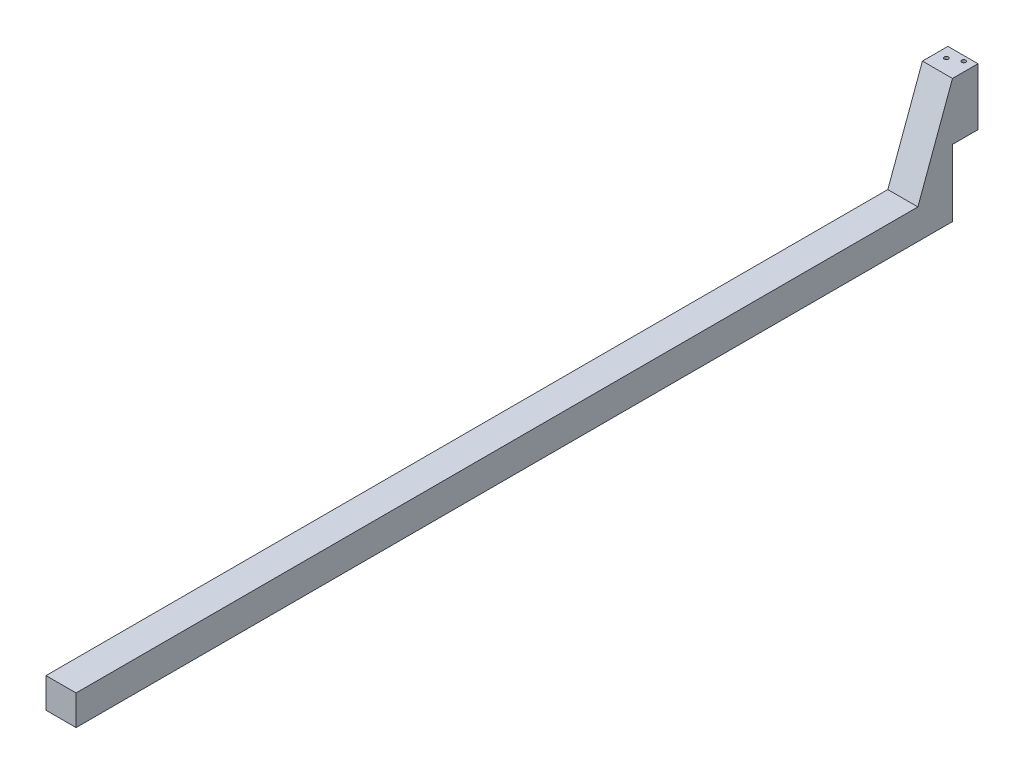
from build123d import *

# Parameters (mm, degrees)
SKETCH1_W                 = 20
SKETCH1_H                 = 82.5
BOSS_EXTRUDE1_DEPTH       = 600
SKETCH2_R                 = 1.35
CUT_EXTRUDE1_DEPTH        = 600
CUT_EXTRUDE4_DEPTH        = 600
SKETCH6_W                 = 16.969486996
SKETCH6_H                 = 44.5
CUT_EXTRUDE5_DEPTH        = 600
F_4_0MM_DOWEL_HOLE3_D     = 4
F_4_0MM_DOWEL_HOLE3_DEPTH = 14
F_4_0MM_DOWEL_HOLE3_TIP   = 1.201721238
F_4_0MM_DOWEL_HOLE2_D     = 4
F_4_0MM_DOWEL_HOLE2_DEPTH = 14
F_4_0MM_DOWEL_HOLE2_TIP   = 1.201721238
F_4_0MM_DOWEL_HOLE4_D     = 4
F_4_0MM_DOWEL_HOLE4_DEPTH = 14
F_4_0MM_DOWEL_HOLE4_TIP   = 1.201721238
F_4_0MM_DOWEL_HOLE5_D     = 4
F_4_0MM_DOWEL_HOLE5_DEPTH = 14
F_4_0MM_DOWEL_HOLE5_TIP   = 1.201721238


with BuildPart() as part:
    # Sketch1 → Boss-Extrude1 (new body)
    with BuildSketch(Plane.XY):
        with Locations((5.517241379, -30.301724138)):
            Rectangle(SKETCH1_W, SKETCH1_H)
    extrude(amount=BOSS_EXTRUDE1_DEPTH)

    # Sketch2 → Cut-Extrude1 (cut)
    with BuildSketch(Plane(origin=(0, 10.948275862, 0), x_dir=(1, 0, 0), z_dir=(0, 1, 0))):
        with Locations(Location((9.329077472, -3.272098327, 0), (0, 0, 270))):
            Circle(SKETCH2_R)
        with Locations(Location((1.705405286, -7.303246399, 0), (0, 0, 270))):
            Circle(SKETCH2_R)
    extrude(amount=-CUT_EXTRUDE1_DEPTH, mode=Mode.SUBTRACT)

    # Sketch5 → Cut-Extrude4 (cut)
    with BuildSketch(Plane.ZY.offset(4.482758621)):
        Polygon((40, -51.551724138), (600, -51.551724138), (600, 10.948275862), (16.969486996, 10.948275862), align=None)
    extrude(amount=-CUT_EXTRUDE4_DEPTH, mode=Mode.SUBTRACT)

    # Sketch6 → Cut-Extrude5 (cut)
    with BuildSketch(Plane.ZY.offset(4.482758621)):
        with Locations((8.484743498, -49.301724138)):
            Rectangle(SKETCH6_W, SKETCH6_H)
    extrude(amount=-CUT_EXTRUDE5_DEPTH, mode=Mode.SUBTRACT)

    # Ø4.0mm Dowel Hole3
    with Locations(Plane.XZ.offset(71.551724138)):
        with Locations((10.517241379, 84.246230703), (10.517241379, 99.246230703), (10.517241379, 224.909334592), (10.517241379, 239.909334592), (10.517241379, 535), (10.517241379, 550)):
            Hole(F_4_0MM_DOWEL_HOLE3_D / 2, depth=F_4_0MM_DOWEL_HOLE3_DEPTH)
            with Locations((0, 0, -(F_4_0MM_DOWEL_HOLE3_DEPTH + F_4_0MM_DOWEL_HOLE3_TIP / 2))):  # 118° drill point
                Cone(0, F_4_0MM_DOWEL_HOLE3_D / 2, F_4_0MM_DOWEL_HOLE3_TIP, mode=Mode.SUBTRACT)

    # Ø4.0mm Dowel Hole2
    with Locations(Plane.XZ.offset(71.551724138)):
        with Locations((0.517241379, 550), (0.517241379, 535)):
            Hole(F_4_0MM_DOWEL_HOLE2_D / 2, depth=F_4_0MM_DOWEL_HOLE2_DEPTH)
            with Locations((0, 0, -(F_4_0MM_DOWEL_HOLE2_DEPTH + F_4_0MM_DOWEL_HOLE2_TIP / 2))):  # 118° drill point
                Cone(0, F_4_0MM_DOWEL_HOLE2_D / 2, F_4_0MM_DOWEL_HOLE2_TIP, mode=Mode.SUBTRACT)

    # Ø4.0mm Dowel Hole4
    with Locations(Plane.XZ.offset(71.551724138)):
        with Locations((0.517241379, 99.246230703), (0.517241379, 84.246230703)):
            Hole(F_4_0MM_DOWEL_HOLE4_D / 2, depth=F_4_0MM_DOWEL_HOLE4_DEPTH)
            with Locations((0, 0, -(F_4_0MM_DOWEL_HOLE4_DEPTH + F_4_0MM_DOWEL_HOLE4_TIP / 2))):  # 118° drill point
                Cone(0, F_4_0MM_DOWEL_HOLE4_D / 2, F_4_0MM_DOWEL_HOLE4_TIP, mode=Mode.SUBTRACT)

    # Ø4.0mm Dowel Hole5
    with Locations(Plane.XZ.offset(71.551724138)):
        with Locations((0, 224.909334592), (0, 239.909334592)):
            Hole(F_4_0MM_DOWEL_HOLE5_D / 2, depth=F_4_0MM_DOWEL_HOLE5_DEPTH)
            with Locations((0, 0, -(F_4_0MM_DOWEL_HOLE5_DEPTH + F_4_0MM_DOWEL_HOLE5_TIP / 2))):  # 118° drill point
                Cone(0, F_4_0MM_DOWEL_HOLE5_D / 2, F_4_0MM_DOWEL_HOLE5_TIP, mode=Mode.SUBTRACT)


solid = part.part
